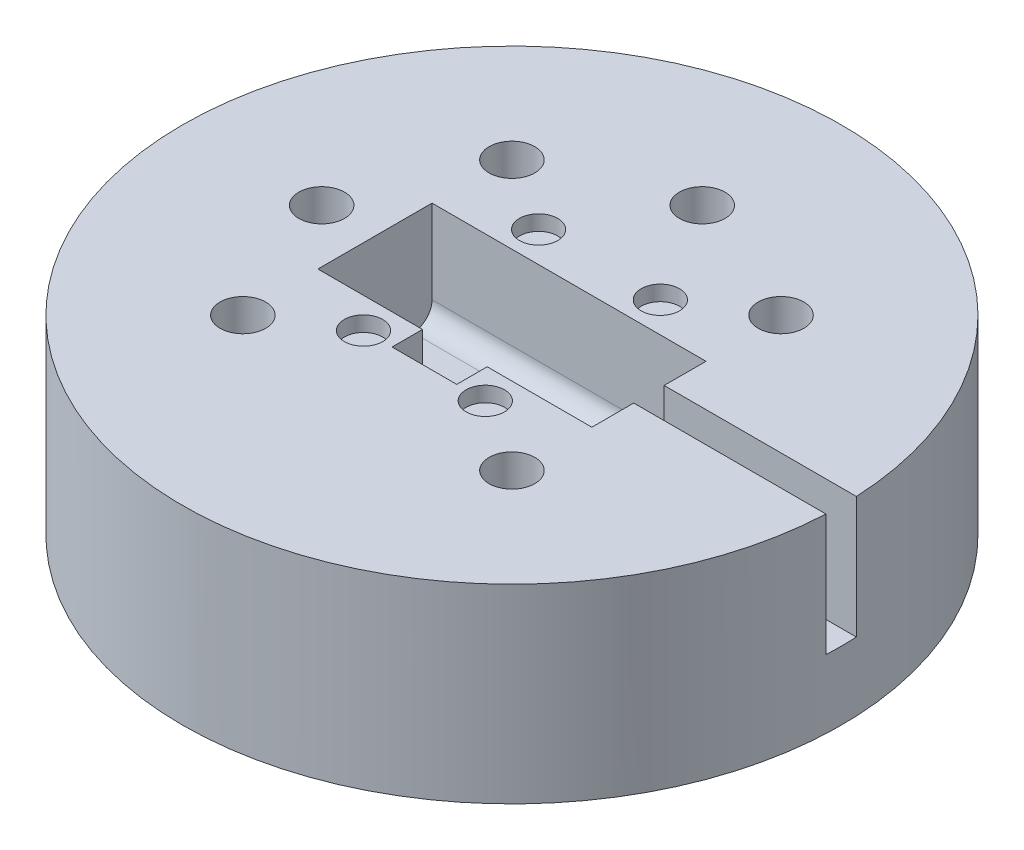
from build123d import *

# Parameters (mm, degrees)
SKETCH1_R           = 86.6
BOSS_EXTRUDE1_DEPTH = 50
SKETCH2_R           = 6
CUT_EXTRUDE1_DEPTH  = 50
SKETCH3_W           = 8.5
SKETCH3_H           = 8
SKETCH3_W_2         = 72
SKETCH3_H_2         = 30
CUT_EXTRUDE2_DEPTH  = 27
FILLET1_R           = 5
FILLET2_R           = 5
CUT_EXTRUDE3_START  = -32
SKETCH4_R           = 4
CUT_EXTRUDE3_DEPTH  = 32
SKETCH5_R           = 5.042988513
CUT_EXTRUDE4_DEPTH  = 4


with BuildPart() as part:
    # Sketch1 → Boss-Extrude1 (new body)
    with BuildSketch(Plane(origin=(0, 0, 0), x_dir=(1, 0, 0), z_dir=(0, 1, 0))):
        with Locations(Location((0, 0, 0), (0, 0, 270))):
            Circle(SKETCH1_R)
    extrude(amount=BOSS_EXTRUDE1_DEPTH)

    # Sketch2 → Cut-Extrude1 (cut)
    with BuildSketch(Plane(origin=(0, 50, 0), x_dir=(1, 0, 0), z_dir=(0, 1, 0))):
        with Locations(Location((0, 50, 0), (0, 0, 270))):
            Circle(SKETCH2_R)
        with Locations(Location((35.355339059, 35.355339059, 0), (0, 0, 270))):
            Circle(SKETCH2_R)
        with Locations(Location((35.355339059, -35.355339059, 0), (0, 0, 270))):
            Circle(SKETCH2_R)
        with Locations(Location((-35.355339059, -35.355339059, 0), (0, 0, 270))):
            Circle(SKETCH2_R)
        with Locations(Location((-50, 0, 0), (0, 0, 270))):
            Circle(SKETCH2_R)
        with Locations(Location((-35.355339059, 35.355339059, 0), (0, 0, 270))):
            Circle(SKETCH2_R)
    extrude(amount=-CUT_EXTRUDE1_DEPTH, mode=Mode.SUBTRACT)

    # Sketch3 → Cut-Extrude2 (cut)
    with BuildSketch(Plane(origin=(0, 50, 0), x_dir=(1, 0, 0), z_dir=(0, 1, 0))):
        with Locations((4.25, -19)):
            Rectangle(SKETCH3_W, SKETCH3_H)
        with Locations((-4.25, -19)):
            Rectangle(SKETCH3_W, SKETCH3_H)
        Rectangle(SKETCH3_W_2, SKETCH3_H_2)
    extrude(amount=-CUT_EXTRUDE2_DEPTH, mode=Mode.SUBTRACT)

    # Fillet1
    fillet1_edges = [part.edges().sort_by_distance(p)[0] for p in [
        (0, 23, -15),
    ]]
    fillet(fillet1_edges, radius=FILLET1_R)

    # Fillet2
    fillet2_edges = [part.edges().sort_by_distance(p)[0] for p in [
        (-22.25, 23, 15),
        (22.25, 23, 15),
    ]]
    fillet(fillet2_edges, radius=FILLET2_R)

    # Sketch4 → Cut-Extrude3 (cut)
    with BuildSketch(Plane(origin=(0, 50, 0), x_dir=(1, 0, 0), z_dir=(0, 1, 0)).offset(CUT_EXTRUDE3_START)):
        with BuildLine():
            Line((86.507571923, 4), (36, 4))
            Line((36, 4), (36, -4))
            Line((36, -4), (86.507571923, -4))
            ThreePointArc((86.507571923, -4), (86.576889897, -2.000533863), (86.6, 0))
            ThreePointArc((86.6, 0), (86.576889897, 2.000533863), (86.507571923, 4))
        make_face()
        with BuildLine():
            Line((36, 4), (18.507571923, 4))
            ThreePointArc((18.507571923, 4), (21.335999048, 2.828427125), (22.507571923, 0))
            ThreePointArc((22.507571923, 0), (21.335999048, -2.828427125), (18.507571923, -4))
            Line((18.507571923, -4), (36, -4))
            Line((36, -4), (36, 4))
        make_face()
        with Locations((18.507571923, 0)):
            Circle(SKETCH4_R)
        with BuildLine():
            ThreePointArc((86.507571923, -4), (90.507571923, 0), (86.507571923, 4))
            ThreePointArc((86.507571923, 4), (86.576889897, 2.000533863), (86.6, 0))
            ThreePointArc((86.6, 0), (86.576889897, -2.000533863), (86.507571923, -4))
        make_face()
    extrude(amount=CUT_EXTRUDE3_DEPTH, mode=Mode.SUBTRACT)

    # Sketch5 → Cut-Extrude4 (cut)
    with BuildSketch(Plane(origin=(0, 50, 0), x_dir=(1, 0, 0), z_dir=(0, 1, 0))):
        with Locations(Location((-16, -23, 0), (0, 0, 270))):
            Circle(SKETCH5_R)
        with Locations(Location((16, -23, 0), (0, 0, 270))):
            Circle(SKETCH5_R)
        with Locations(Location((16, 23, 0), (0, 0, 270))):
            Circle(SKETCH5_R)
        with Locations(Location((-16, 23, 0), (0, 0, 270))):
            Circle(SKETCH5_R)
    extrude(amount=-CUT_EXTRUDE4_DEPTH, mode=Mode.SUBTRACT)


solid = part.part
